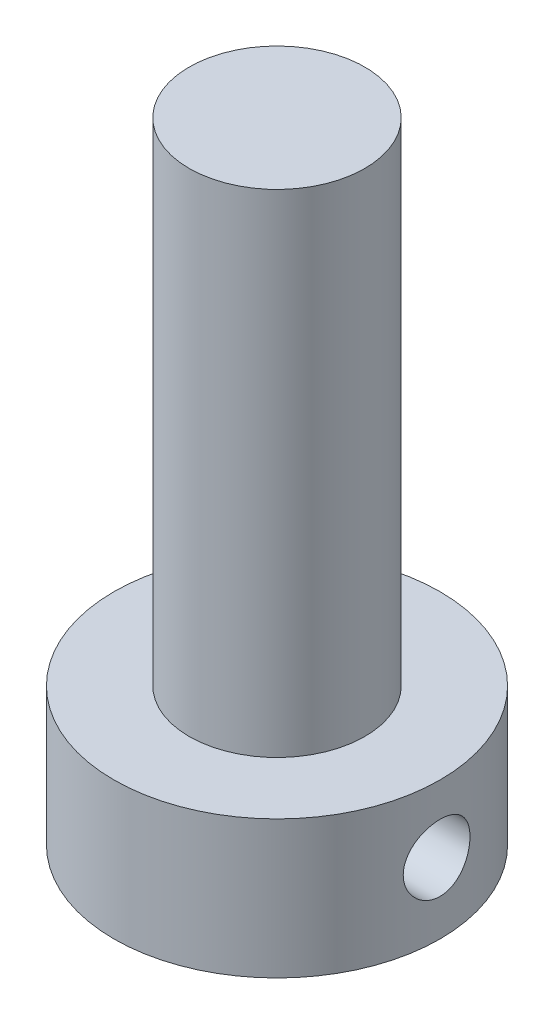
from build123d import *

# Parameters (mm, degrees)
SKETCH2_R           = 11.6
BOSS_EXTRUDE1_DEPTH = 9.8
SKETCH7_R           = 6.25
BOSS_EXTRUDE3_DEPTH = 35
SKETCH3_R           = 2.375
CUT_EXTRUDE1_DEPTH  = 5
SCALE1_SCALE        = 0.8


with BuildPart() as part:
    # Sketch2 → Boss-Extrude1 (new body)
    with BuildSketch(Plane(origin=(0, 0, 0), x_dir=(1, 0, 0), z_dir=(0, 1, 0))):
        with Locations(Location((0, 0, 0), (0, 0, 270))):
            Circle(SKETCH2_R)
    extrude(amount=BOSS_EXTRUDE1_DEPTH)

    # Sketch7 → Boss-Extrude3 (add)
    with BuildSketch(Plane(origin=(0, 9.8, 0), x_dir=(1, 0, 0), z_dir=(0, 1, 0))):
        with Locations(Location((0, 0, 0), (0, 0, 270))):
            Circle(SKETCH7_R)
    extrude(amount=BOSS_EXTRUDE3_DEPTH)

    # Sketch3 → Cut-Extrude1 (cut)
    with BuildSketch(Plane(origin=(11.6, 0, 0), x_dir=(0, 0, -1), z_dir=(1, 0, 0))):
        with Locations((0, 5)):
            Circle(SKETCH3_R)
    extrude(amount=-CUT_EXTRUDE1_DEPTH, mode=Mode.SUBTRACT)


with BuildPart() as part_1:
    # Scale1: scaled about (-0.095056518, 16.420693109, 4.829e-06)
    add(part.part.scale(SCALE1_SCALE).moved(Location((-0.019011304, 3.284138622, 9.66e-07))))


solid = part_1.part
